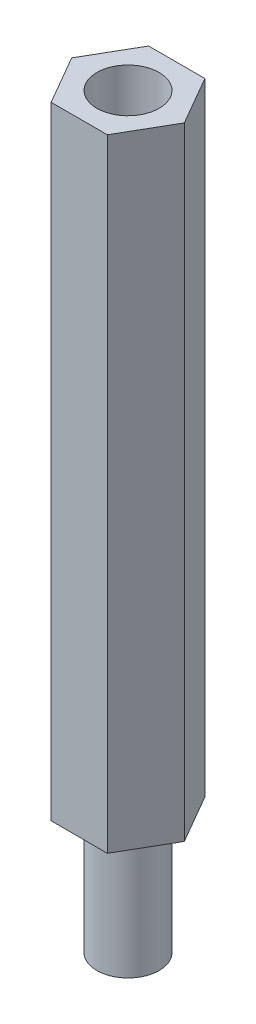
from build123d import *

# Parameters (mm, degrees)
EXTRUDE_1_DEPTH     = 30
SKETCH_2_R          = 1.5
EXTRUDE_2_DEPTH     = 6
SKETCH_3_R          = 1.5
CUT_EXTRUDE_1_DEPTH = 24


with BuildPart() as part:
    # Эскиз1 → Бобышка-Вытянуть1 (new body)
    with BuildSketch(Plane(origin=(0, 0, 0), x_dir=(1, 0, 0), z_dir=(0, 1, 0))):
        Polygon((1.356773133, -2.35), (2.713546265, 0), (1.356773133, 2.35), (-1.356773133, 2.35), (-2.713546265, 0), (-1.356773133, -2.35), align=None)
    extrude(amount=EXTRUDE_1_DEPTH)

    # Эскиз2 → Бобышка-Вытянуть2 (add)
    with BuildSketch(Plane.XZ):
        with Locations(Location((0, 0, 0), (0, 0, 90))):
            Circle(SKETCH_2_R)
    extrude(amount=EXTRUDE_2_DEPTH)

    # Эскиз3 → Вырез-Вытянуть1 (cut)
    with BuildSketch(Plane(origin=(0, 30, 0), x_dir=(1, 0, 0), z_dir=(0, 1, 0))):
        with Locations(Location((0, 0, 0), (0, 0, 270))):
            Circle(SKETCH_3_R)
    extrude(amount=-CUT_EXTRUDE_1_DEPTH, mode=Mode.SUBTRACT)


solid = part.part
